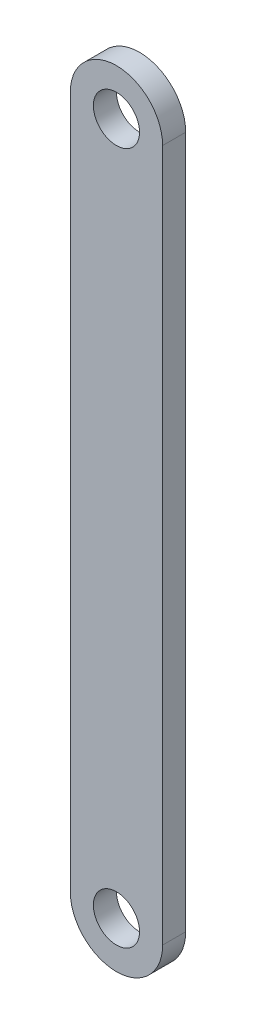
from build123d import *

# Parameters (mm, degrees)
SKETCH1_R           = 12.7
BOSS_EXTRUDE1_DEPTH = 12.7


with BuildPart() as part:
    # Sketch1 → Boss-Extrude1 (new body)
    with BuildSketch(Plane.XY):
        with BuildLine():
            Line((-25.4, -381), (-25.4, 0))
            ThreePointArc((-25.4, 0), (0, 25.4), (25.4, 0))
            Line((25.4, 0), (25.4, -381))
            ThreePointArc((25.4, -381), (0, -406.4), (-25.4, -381))
        make_face()
        Circle(SKETCH1_R, mode=Mode.SUBTRACT)
        with Locations((0, -381)):
            Circle(SKETCH1_R, mode=Mode.SUBTRACT)
    extrude(amount=BOSS_EXTRUDE1_DEPTH)


solid = part.part
